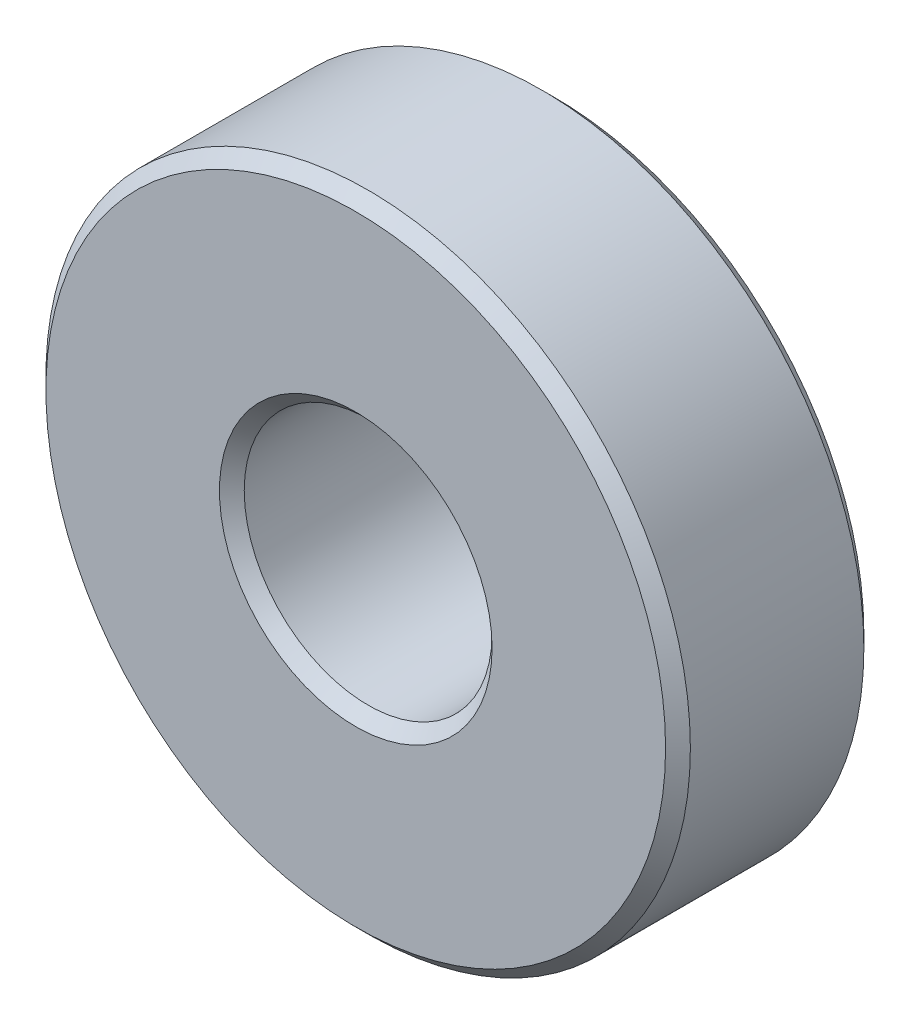
from build123d import *

# Parameters (mm, degrees)
SKETCH1_R           = 13
BOSS_EXTRUDE1_DEPTH = 8
SKETCH2_R           = 5
CUT_EXTRUDE1_DEPTH  = 8
CHAMFER1_SIZE       = 0.5


with BuildPart() as part:
    # Sketch1 → Boss-Extrude1 (new body)
    with BuildSketch(Plane.XY):
        Circle(SKETCH1_R)
    extrude(amount=BOSS_EXTRUDE1_DEPTH)

    # Sketch2 → Cut-Extrude1 (cut)
    with BuildSketch(Plane.XY.offset(8)):
        Circle(SKETCH2_R)
    extrude(amount=-CUT_EXTRUDE1_DEPTH, mode=Mode.SUBTRACT)

    # Chamfer1
    chamfer1_edges = [part.edges().sort_by_distance(p)[0] for p in [
        (-13, 0, 0),
        (-13, 0, 8),
        (-5, 0, 0),
        (-5, 0, 8),
    ]]
    chamfer(chamfer1_edges, length=CHAMFER1_SIZE)


solid = part.part
